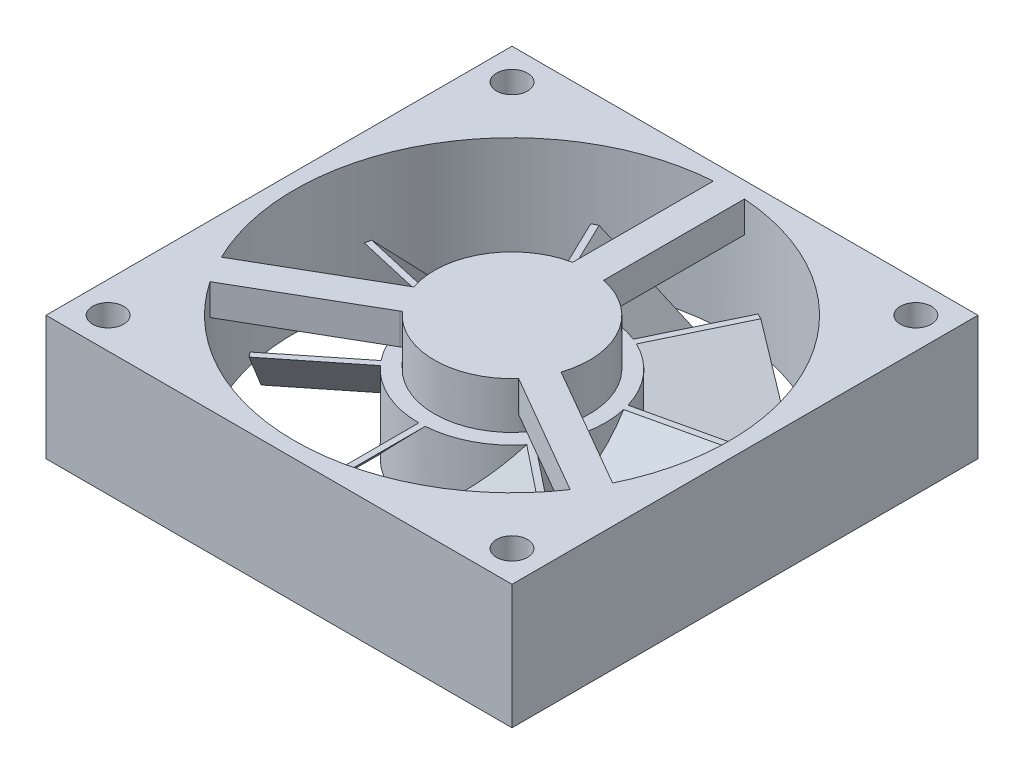
from build123d import *

# Parameters (mm, degrees)
SKETCH1_W             = 30
SKETCH1_H             = 30
SKETCH1_R             = 14
BOSS_EXTRUDE1_DEPTH   = 8
SKETCH2_R             = 5
BOSS_EXTRUDE2_DEPTH   = 8
BOSS_EXTRUDE3_DEPTH   = 2
F_2_0MM_DOWEL_HOLE1_D = 2
SKETCH7_R             = 6
BOSS_EXTRUDE4_DEPTH   = 5
BOSS_EXTRUDE5_DEPTH   = 12
CIRPATTERN1_COUNT     = 7


with BuildPart() as part:
    # Sketch1 → Boss-Extrude1 (new body)
    with BuildSketch(Plane(origin=(0, 0, 0), x_dir=(1, 0, 0), z_dir=(0, 1, 0))):
        Rectangle(SKETCH1_W, SKETCH1_H)
        with Locations(Location((0, 0, 0), (0, 0, 270))):
            Circle(SKETCH1_R, mode=Mode.SUBTRACT)
    extrude(amount=BOSS_EXTRUDE1_DEPTH)



with BuildPart() as body_2:
    # Sketch2 → Boss-Extrude2 (new body)
    with BuildSketch(Plane(origin=(0, 0, 0), x_dir=(1, 0, 0), z_dir=(0, 1, 0))):
        with Locations(Location((0, 0, 0), (0, 0, 270))):
            Circle(SKETCH2_R)
    extrude(amount=BOSS_EXTRUDE2_DEPTH)


with BuildPart() as part_1:
    add(part.part)

    add(body_2.part)  # Boss-Extrude3 merges body 2
    # Sketch3 → Boss-Extrude3 (add)
    with BuildSketch(Plane(origin=(0, 8, 0), x_dir=(1, 0, 0), z_dir=(0, 1, 0))):
        with BuildLine():
            Line((-1, 5), (-1, 14))
            ThreePointArc((-1, 14), (0, 15), (1, 14))
            Line((1, 14), (1, 5))
            ThreePointArc((1, 5), (0, 4), (-1, 5))
        make_face()
        with BuildLine():
            Line((-3.830127019, -3.366025404), (-11.624355653, -7.866025404))
            ThreePointArc((-11.624355653, -7.866025404), (-12.990381057, -7.5), (-12.624355653, -6.133974596))
            Line((-12.624355653, -6.133974596), (-4.830127019, -1.633974596))
            ThreePointArc((-4.830127019, -1.633974596), (-3.464101615, -2), (-3.830127019, -3.366025404))
        make_face()
        with BuildLine():
            Line((4.830127019, -1.633974596), (12.624355653, -6.133974596))
            ThreePointArc((12.624355653, -6.133974596), (12.990381057, -7.5), (11.624355653, -7.866025404))
            Line((11.624355653, -7.866025404), (3.830127019, -3.366025404))
            ThreePointArc((3.830127019, -3.366025404), (3.464101615, -2), (4.830127019, -1.633974596))
        make_face()
    extrude(amount=-BOSS_EXTRUDE3_DEPTH)

    # Ø2.0mm Dowel Hole1 (through all)
    with Locations(Plane(origin=(0, 8, 0), x_dir=(1, 0, 0), z_dir=(0, 1, 0))):
        with Locations((13, 13), (-13, 13), (-13, -13), (13, -13)):
            Hole(F_2_0MM_DOWEL_HOLE1_D / 2)

    # Sketch7 → Boss-Extrude4 (add)
    with BuildSketch(Plane.XZ):
        with Locations(Location((0, 0, 0), (0, 0, 270))):
            Circle(SKETCH7_R)
    extrude(amount=-BOSS_EXTRUDE4_DEPTH)

    # Sketch9 → Boss-Extrude5 (add)
    with BuildSketch(Plane.XY):
        Polygon((0, 5), (-4.898979486, 0), (-4.498979486, 0), (0.4, 5), align=None)
    boss_extrude5 = extrude(amount=BOSS_EXTRUDE5_DEPTH)

    # CirPattern1: Boss-Extrude5 ×7 about axis
    cirpattern1_axis = Axis((0, 0, 0), (0, 1, 0))
    for i in range(1, CIRPATTERN1_COUNT):
        add(boss_extrude5.rotate(cirpattern1_axis, i * 360 / CIRPATTERN1_COUNT))


solid = part_1.part
